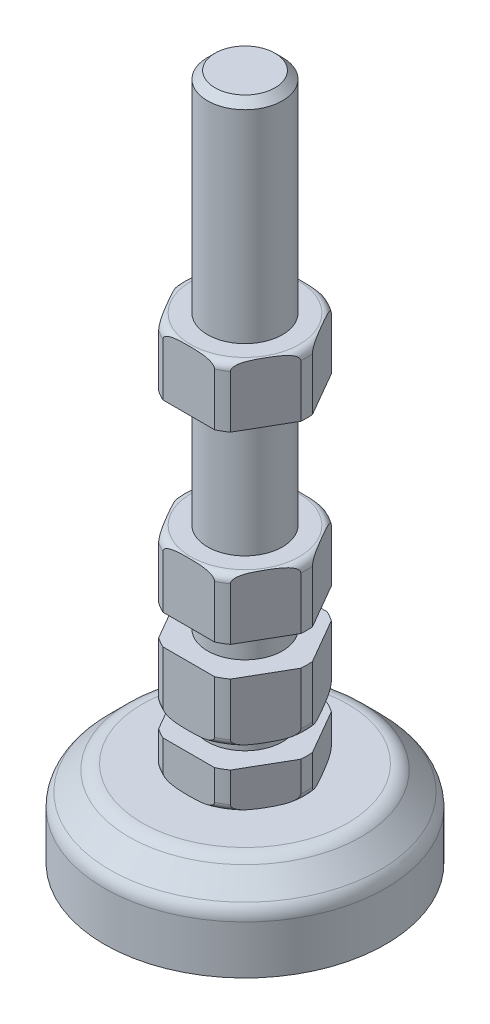
from build123d import *

# Parameters (mm, degrees)
CUT_EXTRUDE_3_REACH = 139.628
SKETCH_2_R          = 71.281307331


with BuildPart() as part:
    # 草圖1 → 旋轉1 (revolve)
    with BuildSketch(Plane.XY, mode=Mode.PRIVATE) as revolve_1_sk:
        with BuildLine():
            Line((0, 0), (37.5, 0))
            Line((37.5, 0), (37.5, 12.928932188))
            ThreePointArc((37.5, 12.928932188), (37.119397663, 14.84234935), (36.035533906, 16.464466094))
            Line((36.035533906, 16.464466094), (30.964466094, 21.535533906))
            ThreePointArc((30.964466094, 21.535533906), (29.34234935, 22.619397663), (27.428932188, 23))
            Line((27.428932188, 23), (14.5, 23))
            ThreePointArc((14.5, 23), (15.914213562, 23.585786438), (16.5, 25))
            Line((16.5, 25), (16.5, 33))
            Line((16.5, 33), (10, 33))
            Line((10, 33), (10, 38))
            Line((10, 38), (14.5, 38))
            ThreePointArc((14.5, 38), (15.914213562, 38.585786438), (16.5, 40))
            Line((16.5, 40), (16.5, 54))
            Line((16.5, 54), (10, 54))
            Line((10, 54), (10, 62))
            Line((10, 62), (16.5, 62))
            Line((16.5, 62), (16.5, 76))
            ThreePointArc((16.5, 76), (15.914213562, 77.414213562), (14.5, 78))
            Line((14.5, 78), (10, 78))
            Line((10, 78), (10, 111))
            Line((10, 111), (16.5, 111))
            Line((16.5, 111), (16.5, 125))
            ThreePointArc((16.5, 125), (15.914213562, 126.414213562), (14.5, 127))
            Line((14.5, 127), (10, 127))
            Line((10, 127), (10, 181))
            Line((10, 181), (8, 183))
            Line((8, 183), (0, 183))
            Line((0, 183), (0, 0))
        make_face()
    revolve(revolve_1_sk.sketch.rotate(Axis((0, -13.80282081, 0), (0, 1, 0)), 90), axis=Axis((0, -13.80282081, 0), (0, 1, 0)))

    # 除料-伸長3: up to this face of the body (flat: up to its plane)
    cut_extrude_3_end = Plane(part.part.faces().sort_by_distance((0, 23, 26.65312483))[0])
    # 草圖2 → 除料-伸長3 (cut, up to the picked face)
    with BuildSketch(Plane(origin=(0, 127, 0), x_dir=(1, 0, 0), z_dir=(0, 1, 0)), mode=Mode.PRIVATE) as cut_extrude_3_sk1:
        Circle(SKETCH_2_R)
        Polygon((17.320508076, 0), (8.660254038, 15), (-8.660254038, 15), (-17.320508076, 0), (-8.660254038, -15), (8.660254038, -15), align=None, mode=Mode.SUBTRACT)
    cut_extrude_3_tool1 = split(extrude(cut_extrude_3_sk1.sketch, amount=-CUT_EXTRUDE_3_REACH, mode=Mode.PRIVATE), bisect_by=cut_extrude_3_end, keep=Keep.BOTH, mode=Mode.PRIVATE)
    add(cut_extrude_3_tool1.solids().sort_by(Axis((-69.265168, 127, 0), (0, -1, 0)))[0], mode=Mode.SUBTRACT)


solid = part.part
